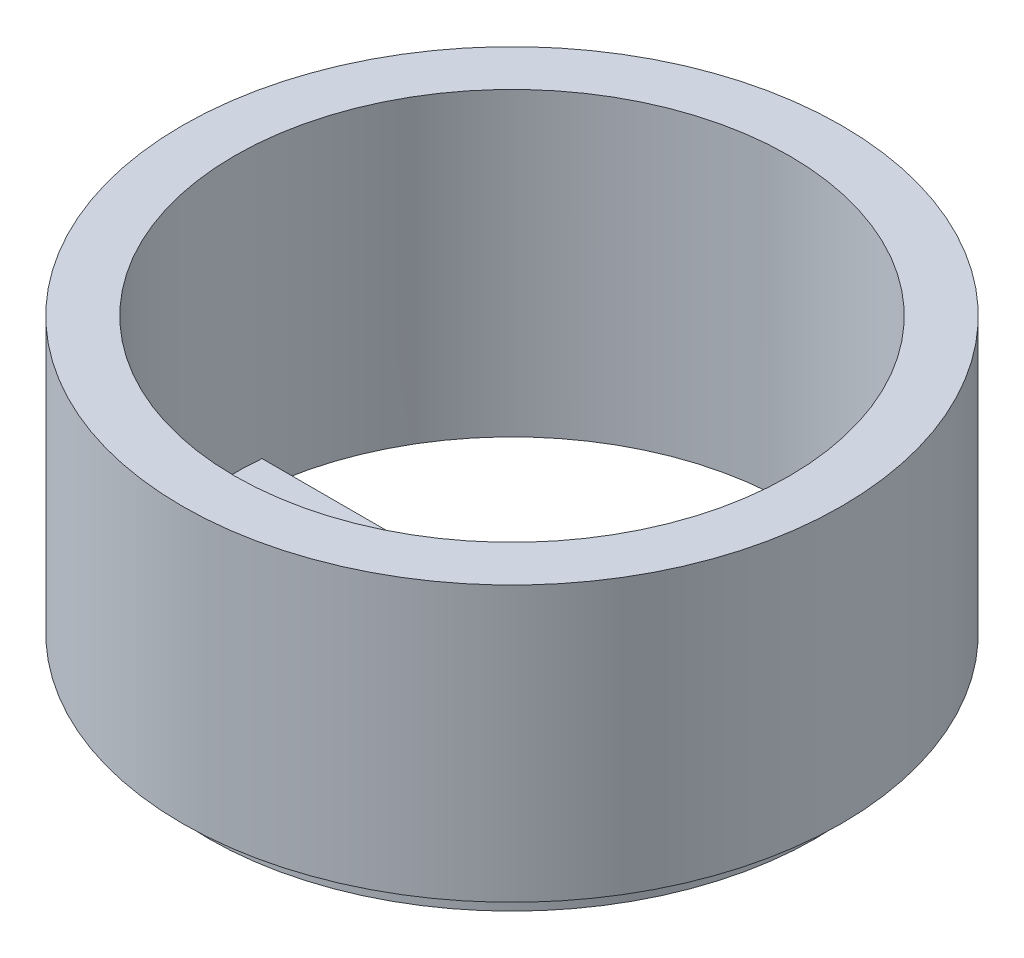
from build123d import *
from build123d.topology import SkipClean

# Parameters (mm, degrees)
CUT_EXTRUDE1_DEPTH = 66.667259393


with BuildPart() as part:
    # Sketch1 → Revolve1 (revolve)
    with BuildSketch(Plane.XY, mode=Mode.PRIVATE) as revolve1_sk:
        Polygon((33.655, 36.5125), (40.005, 36.5125), (40.005, 3.175), (36.83, 3.175), (36.83, 0), (33.655, 0), (0, 0), (0, 3.175), (33.655, 3.175), align=None)
    revolve(revolve1_sk.sketch.rotate(Axis((0, 0, 0), (0, 1, 0)), 90), axis=Axis((0, 0, 0), (0, 1, 0)))

    # Sketch2 → Cut-Extrude1 (cut, through all)
    with SkipClean():  # the faces are left unmerged after this step: merging them gives an invalid solid
        with BuildSketch(Plane(origin=(0, 3.175, 0), x_dir=(1, 0, 0), z_dir=(0, 1, 0))):
            with BuildLine():
                Line((-33.504901134, 3.175), (33.504901134, 3.175))
                ThreePointArc((33.504901134, 3.175), (0, 33.655), (-33.504901134, 3.175))
            make_face()
            with BuildLine():
                Line((-33.504901134, -3.175), (33.504901134, -3.175))
                ThreePointArc((33.504901134, -3.175), (0, -33.655), (-33.504901134, -3.175))
            make_face()
        extrude(amount=-CUT_EXTRUDE1_DEPTH, mode=Mode.SUBTRACT)


solid = part.part
